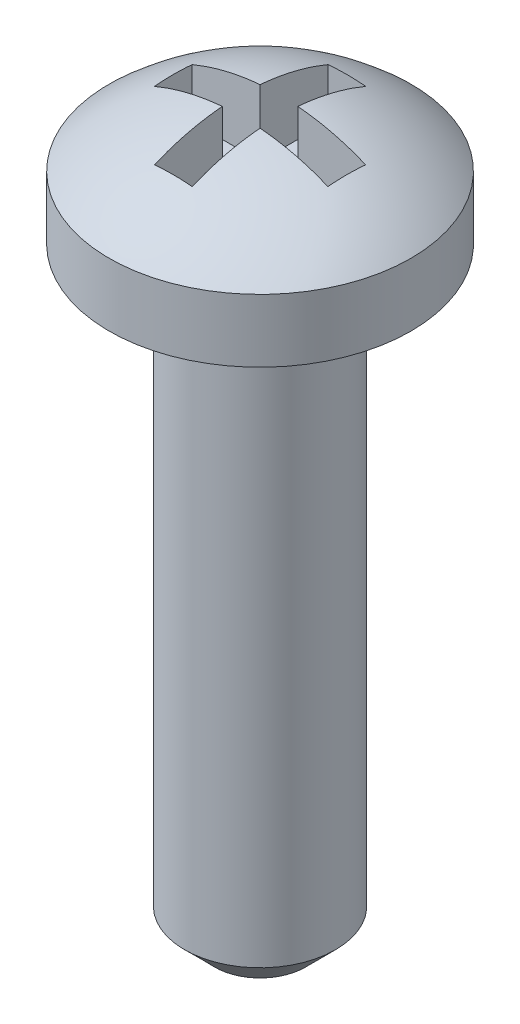
from build123d import *

# Parameters (mm, degrees)
CUT_EXTRUDE1_START = -0.7
CUT_EXTRUDE1_DEPTH = 8.785281374


with BuildPart() as part:
    # Sketch1 → Revolve1 (revolve)
    with BuildSketch(Plane.XY, mode=Mode.PRIVATE) as revolve1_sk:
        with BuildLine():
            Line((-2, 0), (-1, 0))
            Line((-1, 0), (-1, -7.6))
            Line((-1, -7.6), (-0.6, -8))
            Line((-0.6, -8), (0, -8))
            Line((0, -8), (0, 1.6))
            ThreePointArc((0, 1.6), (-1.070466269, 1.402517077), (-2, 0.836067977))
            Line((-2, 0.836067977), (-2, 0))
        make_face()
    revolve(revolve1_sk.sketch.rotate(Axis((0, -8, 0), (0, 1, 0)), 180), axis=Axis((0, -8, 0), (0, 1, 0)))

    # Sketch2 → Cut-Extrude1 (cut, through all)
    with BuildSketch(Plane.XZ.offset(CUT_EXTRUDE1_START)):
        Polygon((-0.25, 1.15), (0.25, 1.15), (0.25, 0.25), (1.15, 0.25), (1.15, -0.25), (0.25, -0.25), (0.25, -1.15), (-0.25, -1.15), (-0.25, -0.25), (-1.15, -0.25), (-1.15, 0.25), (-0.25, 0.25), align=None)
    extrude(amount=-CUT_EXTRUDE1_DEPTH, mode=Mode.SUBTRACT)


solid = part.part
